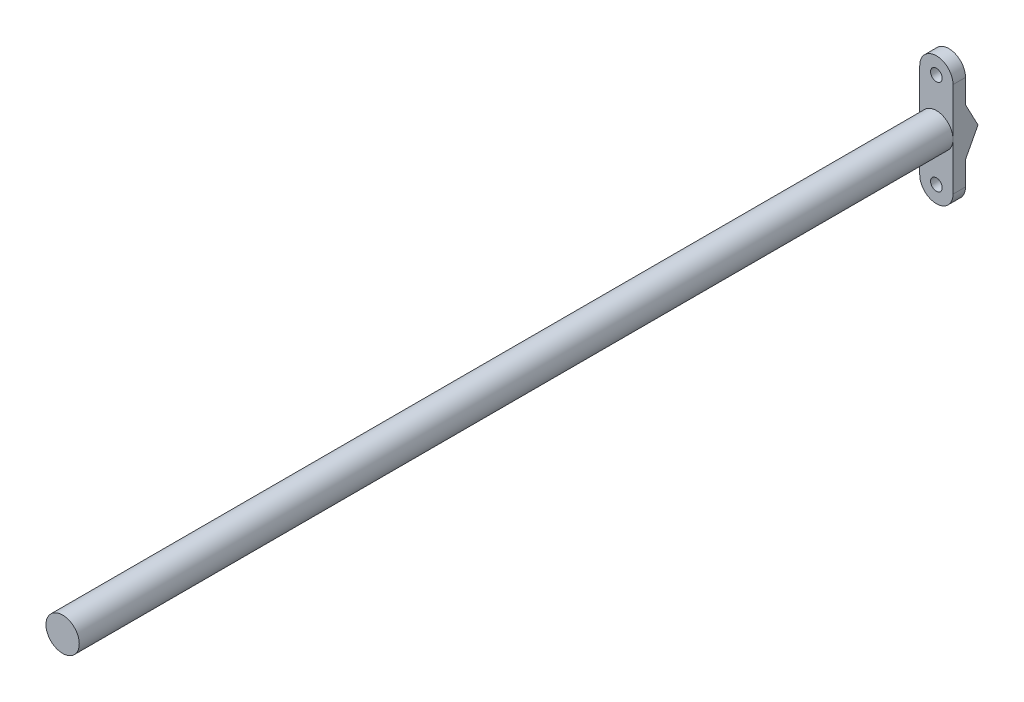
from build123d import *

# Parameters (mm, degrees)
SKETCH_1_R          = 1.4
EXTRUDE_1_DEPTH     = 3
SKETCH_2_R          = 4
EXTRUDE_3_DEPTH     = 210
SKETCH_3_W          = 8
SKETCH_3_H          = 5.7
EXTRUDE_4_DEPTH     = 3
CUT_EXTRUDE_1_DEPTH = 214.705779051


with BuildPart() as part:
    # 草图1 → 凸台-拉伸1 (new body)
    with BuildSketch(Plane.XY):
        with BuildLine():
            Line((-4, -11.4), (-4, 11.4))
            ThreePointArc((-4, 11.4), (0, 15.4), (4, 11.4))
            Line((4, 11.4), (4, -11.4))
            ThreePointArc((4, -11.4), (0, -15.4), (-4, -11.4))
        make_face()
        with Locations((0, 11.4)):
            Circle(SKETCH_1_R, mode=Mode.SUBTRACT)
        with Locations(Location((0, -11.4, 0), (0, 0, 180))):
            Circle(SKETCH_1_R, mode=Mode.SUBTRACT)
    extrude(amount=EXTRUDE_1_DEPTH)

    # 草图2 → 凸台-拉伸3 (add)
    with BuildSketch(Plane.XY.offset(3)):
        Circle(SKETCH_2_R)
    extrude(amount=EXTRUDE_3_DEPTH)

    # 草图3 → 凸台-拉伸4 (add)
    with BuildSketch(Plane(origin=(0, 0, 0), x_dir=(-1, 0, 0), z_dir=(0, 0, -1))):
        with Locations((0, 2.85)):
            Rectangle(SKETCH_3_W, SKETCH_3_H)
        with Locations((0, -2.85)):
            Rectangle(SKETCH_3_W, SKETCH_3_H)
    extrude(amount=EXTRUDE_4_DEPTH)

    # 草图5 → 切除-拉伸1 (cut, through all)
    with BuildSketch(Plane(origin=(4, 0, 0), x_dir=(0, 0, -1), z_dir=(1, 0, 0))):
        Polygon((0, 5.7), (3, 0), (3, 5.7), align=None)
        Polygon((3, -5.7), (3, 0), (0, -5.7), align=None)
    extrude(amount=-CUT_EXTRUDE_1_DEPTH, mode=Mode.SUBTRACT)


solid = part.part
